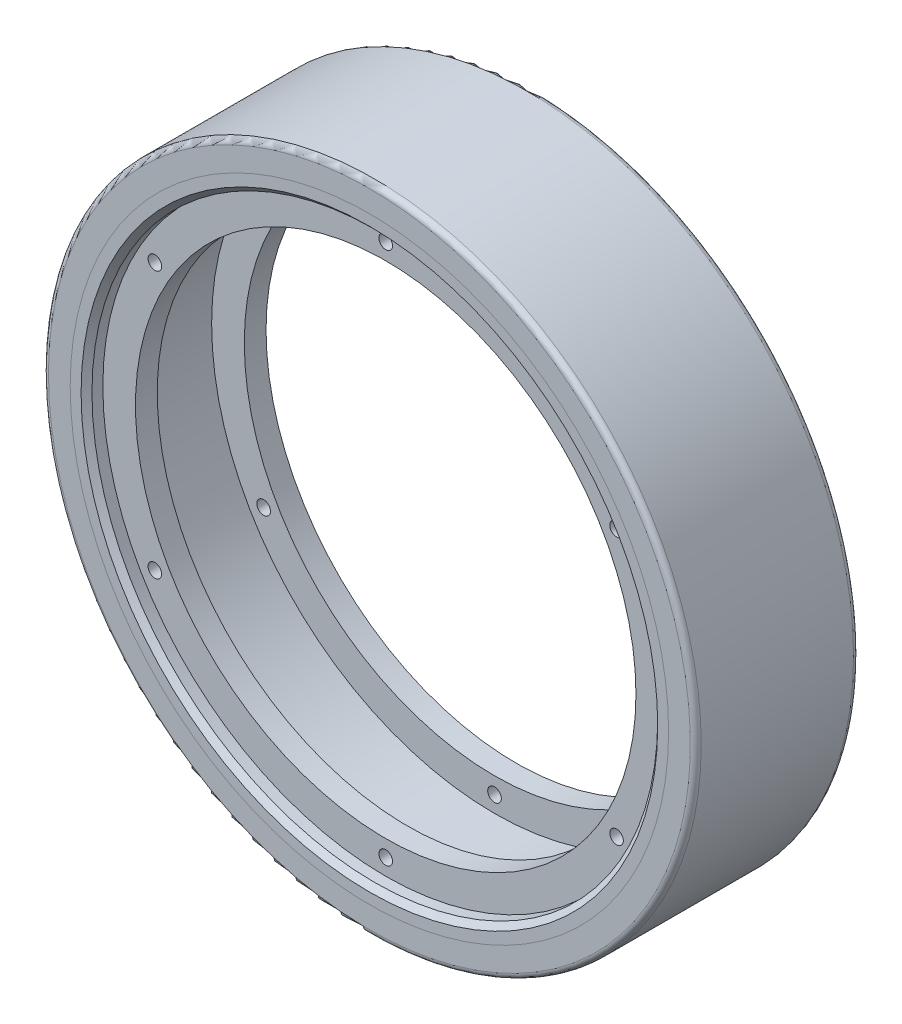
from build123d import *

# Parameters (mm, degrees)
SKETCH_1_R               = 55
EXTRUDE_1_DEPTH          = 15
SKETCH_2_R               = 52
CUT_EXTRUDE_1_DEPTH      = 3
SKETCH_3_R               = 46
CUT_EXTRUDE_2_DEPTH      = 194
SKETCH_4_R               = 52
CUT_EXTRUDE_3_DEPTH      = 8
HOLE_WIZARD_M3_1_D       = 2.5
PATTERN_CIRCULAR_1_COUNT = 6
CHAMFER_1_SIZE           = 1
SKETCH_8_R               = 60
SKETCH_8_R_2             = 55
EXTRUDE_2_DEPTH          = 30
FILLET_2_R               = 1


with BuildPart() as part:
    # 草图1 → 凸台-拉伸1 (new, symmetric)
    with BuildSketch(Plane.XY):
        Circle(SKETCH_1_R)
    extrude(amount=EXTRUDE_1_DEPTH, both=True)

    # 草图2 → 切除-拉伸1 (cut)
    with BuildSketch(Plane.XY.offset(15)):
        Circle(SKETCH_2_R)
    cut_extrude_1 = extrude(amount=-CUT_EXTRUDE_1_DEPTH, mode=Mode.SUBTRACT)

    # 镜向1: 切除-拉伸1 across plane
    add(cut_extrude_1.mirror(Plane.XY), mode=Mode.SUBTRACT)

    # 草图3 → 切除-拉伸2 (cut)
    with BuildSketch(Plane(origin=(0, 0, -12), x_dir=(-1, 0, 0), z_dir=(0, 0, -1))):
        Circle(SKETCH_3_R)
    extrude(amount=-CUT_EXTRUDE_2_DEPTH, mode=Mode.SUBTRACT)

    # 草图4 → 切除-拉伸3 (cut, symmetric)
    with BuildSketch(Plane.XY):
        Circle(SKETCH_4_R)
    extrude(amount=CUT_EXTRUDE_3_DEPTH, both=True, mode=Mode.SUBTRACT)

    # M3 螺纹孔1 (through all)
    with Locations(Plane.XY.offset(12)):
        with Locations((0, 49)):
            hole_wizard_m3_1 = Hole(HOLE_WIZARD_M3_1_D / 2)

    # 阵列(圆周)1: M3 螺纹孔1 ×6 about axis
    pattern_circular_1_axis = Axis((0, 0, 0), (0, 0, 1))
    for i in range(1, PATTERN_CIRCULAR_1_COUNT):
        add(hole_wizard_m3_1.rotate(pattern_circular_1_axis, i * 360 / PATTERN_CIRCULAR_1_COUNT), mode=Mode.SUBTRACT)

    # 倒角1
    chamfer_1_edges = [part.edges().sort_by_distance(p)[0] for p in [
        (-52, 0, -15),
        (-52, 0, 15),
    ]]
    chamfer(chamfer_1_edges, length=CHAMFER_1_SIZE)


with BuildPart() as body_2:
    # 草图8 → 凸台-拉伸2 (new body)
    with BuildSketch(Plane(origin=(0, 0, -15), x_dir=(-1, 0, 0), z_dir=(0, 0, -1))):
        Circle(SKETCH_8_R)
        Circle(SKETCH_8_R_2, mode=Mode.SUBTRACT)
    extrude(amount=-EXTRUDE_2_DEPTH)

    # 圆角2
    fillet_2_edges = [body_2.edges().sort_by_distance(p)[0] for p in [
        (60, 0, -15),
        (60, 0, 15),
    ]]
    fillet(fillet_2_edges, radius=FILLET_2_R)


solid = Compound([part.part, body_2.part])
